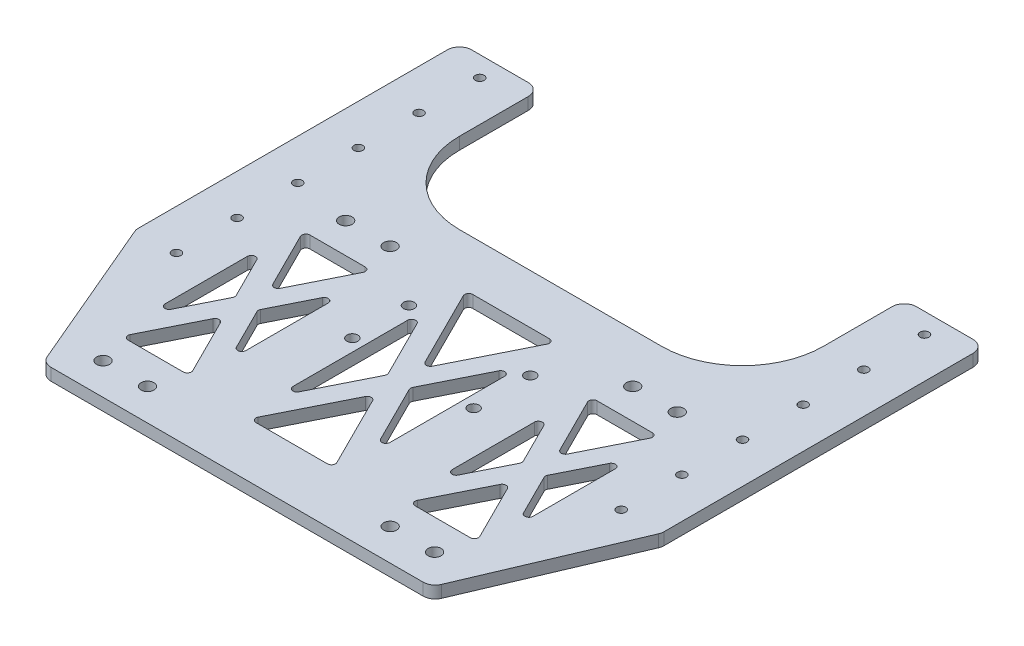
from build123d import *

# Parameters (mm, degrees)
SKETCH_1_R          = 1.1
SKETCH_1_R_2        = 1.35
EXTRUDE_1_DEPTH     = 3
SKETCH_2_R          = 1.6
CUT_EXTRUDE_1_DEPTH = 177.943493805
CUT_EXTRUDE_2_DEPTH = 177.943493805
FILLET_1_R          = 3
FILLET_2_R          = 1
FILLET_3_R          = 20


with BuildPart() as part:
    # 草图1 → 凸台-拉伸1 (new body)
    with BuildSketch(Plane(origin=(0, 0, 0), x_dir=(1, 0, 0), z_dir=(0, 1, 0))):
        Polygon((20, 120), (20, 80), (110, 80), (110, 120), (130, 120), (130, 0), (0, 0), (0, 120), align=None)
        with Locations(Location((10, 115, 0), (0, 0, 270))):
            Circle(SKETCH_1_R, mode=Mode.SUBTRACT)
        with Locations(Location((120, 115, 0), (0, 0, 90))):
            Circle(SKETCH_1_R, mode=Mode.SUBTRACT)
        with Locations(Location((10, 100, 0), (0, 0, 270))):
            Circle(SKETCH_1_R, mode=Mode.SUBTRACT)
        with Locations(Location((120, 100, 0), (0, 0, 90))):
            Circle(SKETCH_1_R, mode=Mode.SUBTRACT)
        with Locations(Location((10, 85, 0), (0, 0, 270))):
            Circle(SKETCH_1_R, mode=Mode.SUBTRACT)
        with Locations(Location((120, 85, 0), (0, 0, 90))):
            Circle(SKETCH_1_R, mode=Mode.SUBTRACT)
        with Locations(Location((10, 70, 0), (0, 0, 270))):
            Circle(SKETCH_1_R, mode=Mode.SUBTRACT)
        with Locations(Location((120, 70, 0), (0, 0, 90))):
            Circle(SKETCH_1_R, mode=Mode.SUBTRACT)
        with Locations(Location((10, 55, 0), (0, 0, 270))):
            Circle(SKETCH_1_R, mode=Mode.SUBTRACT)
        with Locations(Location((120, 55, 0), (0, 0, 90))):
            Circle(SKETCH_1_R, mode=Mode.SUBTRACT)
        with Locations(Location((10, 40, 0), (0, 0, 270))):
            Circle(SKETCH_1_R, mode=Mode.SUBTRACT)
        with Locations(Location((120, 40, 0), (0, 0, 90))):
            Circle(SKETCH_1_R, mode=Mode.SUBTRACT)
        with Locations(Location((50, 57.5, 0), (0, 0, 270))):
            Circle(SKETCH_1_R_2, mode=Mode.SUBTRACT)
        with Locations(Location((50, 43.5, 0), (0, 0, 270))):
            Circle(SKETCH_1_R_2, mode=Mode.SUBTRACT)
        with Locations(Location((80, 43.5, 0), (0, 0, 90))):
            Circle(SKETCH_1_R_2, mode=Mode.SUBTRACT)
        with Locations(Location((80, 57.5, 0), (0, 0, 90))):
            Circle(SKETCH_1_R_2, mode=Mode.SUBTRACT)
    extrude(amount=EXTRUDE_1_DEPTH)

    # 草图2 → 切除-拉伸1 (cut, through all)
    with BuildSketch(Plane.XZ):
        with Locations(Location((24, -7.85, 0), (0, 0, 270))):
            Circle(SKETCH_2_R)
        with Locations(Location((35, -7.85, 0), (0, 0, 90))):
            Circle(SKETCH_2_R)
        with Locations(Location((35, -67.85, 0), (0, 0, 270))):
            Circle(SKETCH_2_R)
        with Locations(Location((24, -67.85, 0), (0, 0, 90))):
            Circle(SKETCH_2_R)
        with Locations(Location((95, -67.85, 0), (0, 0, 90))):
            Circle(SKETCH_2_R)
        with Locations(Location((106, -67.85, 0), (0, 0, 270))):
            Circle(SKETCH_2_R)
        with Locations(Location((95, -7.85, 0), (0, 0, 270))):
            Circle(SKETCH_2_R)
        with Locations(Location((106, -7.85, 0), (0, 0, 90))):
            Circle(SKETCH_2_R)
        Polygon((37.954915028, -15.35), (29.5, -32.259830056), (21.045084972, -15.35), align=None)
        Polygon((19.5, -23.440169944), (26.704915028, -37.85), (19.5, -52.259830056), align=None)
        Polygon((29.5, -43.440169944), (21.045084972, -60.35), (37.954915028, -60.35), align=None)
        Polygon((90.5, -23.440169944), (97.704915028, -37.85), (90.5, -52.259830056), align=None)
        Polygon((39.5, -23.440169944), (39.5, -52.259830056), (32.295084972, -37.85), align=None)
        Polygon((100.5, -43.440169944), (92.045084972, -60.35), (108.954915028, -60.35), align=None)
        Polygon((110.5, -23.440169944), (103.295084972, -37.85), (110.5, -52.259830056), align=None)
        Polygon((92.045084972, -15.35), (108.954915028, -15.35), (100.5, -32.259830056), align=None)
        Polygon((54.545084972, -13.5), (75.454915028, -13.5), (65, -34.409830056), align=None)
        Polygon((53, -21.590169944), (62.204915028, -40), (53, -58.409830056), align=None)
        Polygon((65, -45.590169944), (76.079915028, -67.75), (53.920084972, -67.75), align=None)
        Polygon((77, -21.590169944), (77, -58.409830056), (67.795084972, -40), align=None)
    extrude(amount=-CUT_EXTRUDE_1_DEPTH, mode=Mode.SUBTRACT)

    # 草图3 → 切除-拉伸2 (cut, through all)
    with BuildSketch(Plane(origin=(0, 3, 0), x_dir=(1, 0, 0), z_dir=(0, 1, 0))):
        Polygon((17, 0), (0, 40), (0, 0), align=None)
        Polygon((113, 0), (130, 40), (130, 0), align=None)
    extrude(amount=-CUT_EXTRUDE_2_DEPTH, mode=Mode.SUBTRACT)

    # 圆角1
    fillet_1_edges = [part.edges().sort_by_distance(p)[0] for p in [
        (0, 1.5, -120),
        (20, 1.5, -120),
        (110, 1.5, -120),
        (130, 1.5, -120),
        (17, 1.5, 0),
        (0, 1.5, -40),
        (113, 1.5, 0),
        (130, 1.5, -40),
    ]]
    fillet(fillet_1_edges, radius=FILLET_1_R)

    # 圆角2
    fillet_2_edges = [part.edges().sort_by_distance(p)[0] for p in [
        (90.5, 1.5, -52.259830056),
        (90.5, 1.5, -23.440169944),
        (97.704915028, 1.5, -37.85),
        (19.5, 1.5, -52.259830056),
        (19.5, 1.5, -23.440169944),
        (26.704915028, 1.5, -37.85),
        (21.045084972, 1.5, -15.35),
        (37.954915028, 1.5, -15.35),
        (29.5, 1.5, -32.259830056),
        (39.5, 1.5, -52.259830056),
        (32.295084972, 1.5, -37.85),
        (39.5, 1.5, -23.440169944),
        (53.920084972, 1.5, -67.75),
        (65, 1.5, -45.590169944),
        (76.079915028, 1.5, -67.75),
        (100.5, 1.5, -32.259830056),
        (92.045084972, 1.5, -15.35),
        (108.954915028, 1.5, -15.35),
        (100.5, 1.5, -43.440169944),
        (108.954915028, 1.5, -60.35),
        (92.045084972, 1.5, -60.35),
        (110.5, 1.5, -23.440169944),
        (110.5, 1.5, -52.259830056),
        (103.295084972, 1.5, -37.85),
        (37.954915028, 1.5, -60.35),
        (21.045084972, 1.5, -60.35),
        (29.5, 1.5, -43.440169944),
        (65, 1.5, -34.409830056),
        (54.545084972, 1.5, -13.5),
        (75.454915028, 1.5, -13.5),
        (77, 1.5, -58.409830056),
        (67.795084972, 1.5, -40),
        (77, 1.5, -21.590169944),
        (53, 1.5, -58.409830056),
        (53, 1.5, -21.590169944),
        (62.204915028, 1.5, -40),
    ]]
    fillet(fillet_2_edges, radius=FILLET_2_R)

    # 圆角3
    fillet_3_edges = [part.edges().sort_by_distance(p)[0] for p in [
        (20, 1.5, -80),
        (110, 1.5, -80),
    ]]
    fillet(fillet_3_edges, radius=FILLET_3_R)


solid = part.part
